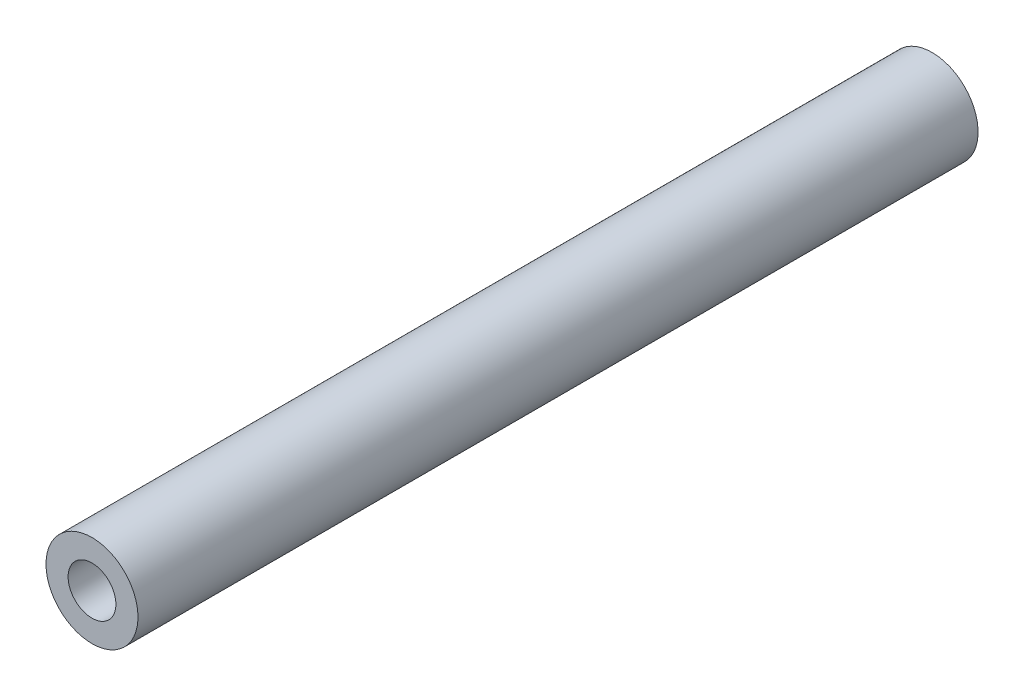
from build123d import *

# Parameters (mm, degrees)
SKETCH1_R           = 3.175
BOSS_EXTRUDE1_DEPTH = 29


with BuildPart() as part:
    # Sketch1 → Boss-Extrude1 (new, symmetric)
    with BuildSketch(Plane.XY):
        with Locations(Location((0, 0, 0), (0, 0, 180))):
            Circle(SKETCH1_R)
    extrude(amount=BOSS_EXTRUDE1_DEPTH, both=True)

    # Sketch3 → M4x0.7 Tapped Hole1 (revolve, cut)
    with BuildSketch(Plane(origin=(0, 0, 29), x_dir=(0, -1, 0), z_dir=(1, 0, 0))):
        Polygon((0, 0), (0, 18.009420021), (1.65, 17.018), (1.65, 0), align=None)
    m4x0_7_tapped_hole1 = revolve(axis=Axis((0, 0, 35.35), (0, 0, -1)), mode=Mode.SUBTRACT)

    # Mirror1: M4x0.7 Tapped Hole1 across plane
    add(m4x0_7_tapped_hole1.mirror(Plane.XY), mode=Mode.SUBTRACT)


solid = part.part
